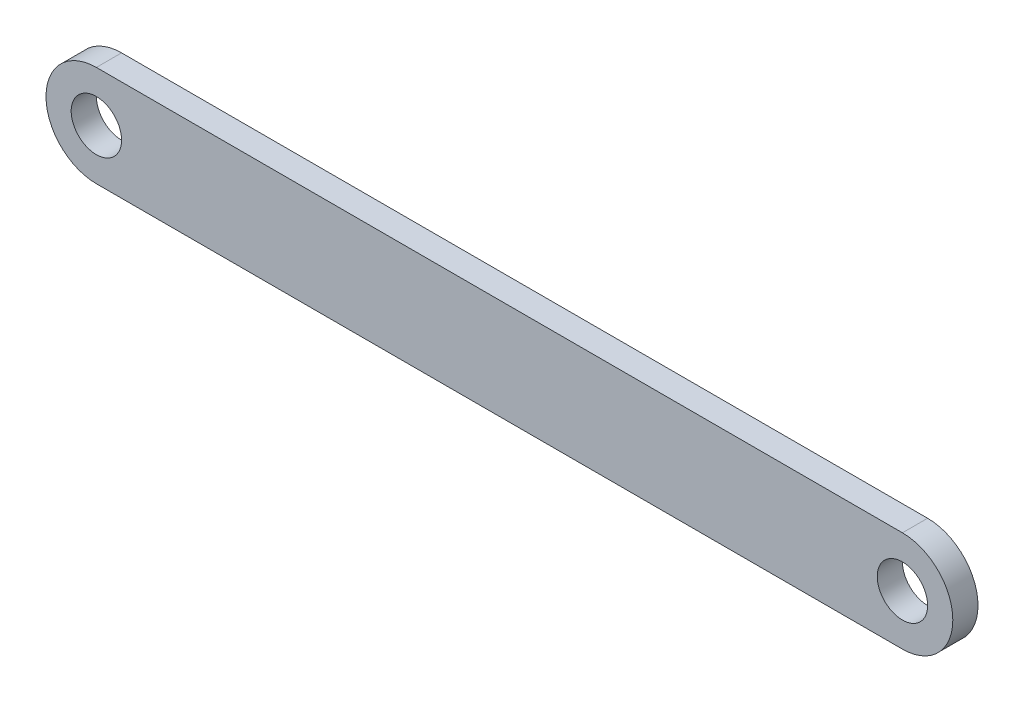
from build123d import *

# Parameters (mm, degrees)
IZIM1_R                     = 5
Y_KSEKLIK_EKSTR_ZYON1_DEPTH = 5


with BuildPart() as part:
    # Çizim1 → Yükseklik-Ekstrüzyon1 (new body)
    with BuildSketch(Plane.XY):
        with BuildLine():
            Line((-38.69815392, 12.886597938), (121.30184608, 12.886597938))
            ThreePointArc((121.30184608, 12.886597938), (131.30184608, 2.886597938), (121.30184608, -7.113402062))
            Line((121.30184608, -7.113402062), (-38.69815392, -7.113402062))
            ThreePointArc((-38.69815392, -7.113402062), (-48.69815392, 2.886597938), (-38.69815392, 12.886597938))
        make_face()
        with Locations((-38.69815392, 2.886597938)):
            Circle(IZIM1_R, mode=Mode.SUBTRACT)
        with Locations((121.30184608, 2.886597938)):
            Circle(IZIM1_R, mode=Mode.SUBTRACT)
    extrude(amount=Y_KSEKLIK_EKSTR_ZYON1_DEPTH)


solid = part.part
